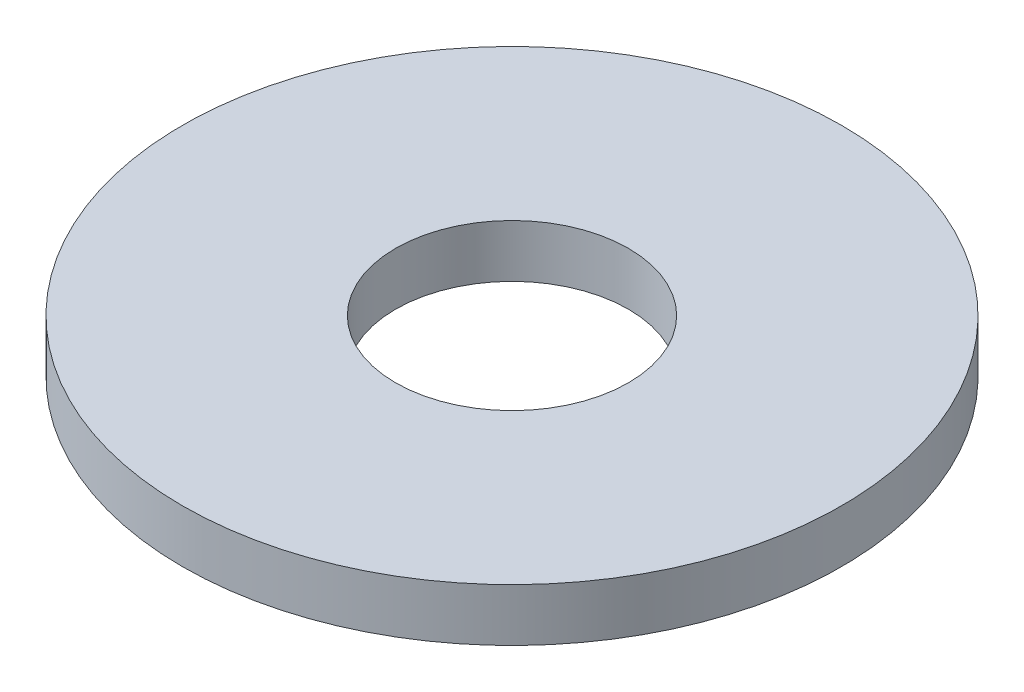
from build123d import *

# Parameters (mm, degrees)
ESQUISSE1_R        = 7.5
ESQUISSE1_R_2      = 2.65
BOSS_EXTRU_1_DEPTH = 1.2


with BuildPart() as part:
    # Esquisse1 → Boss.-Extru.1 (new body)
    with BuildSketch(Plane(origin=(0, 0, 0), x_dir=(1, 0, 0), z_dir=(0, 1, 0))):
        with Locations(Location((0, 0, 0), (0, 0, 270))):
            Circle(ESQUISSE1_R)
        with Locations(Location((0, 0, 0), (0, 0, 270))):
            Circle(ESQUISSE1_R_2, mode=Mode.SUBTRACT)
    extrude(amount=BOSS_EXTRU_1_DEPTH)


solid = part.part
